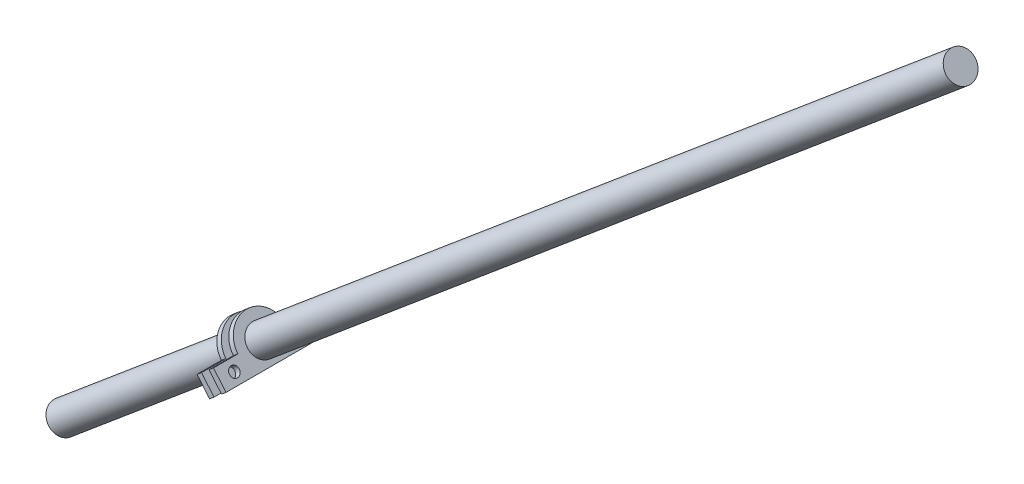
from build123d import *

# Parameters (mm, degrees)
S_P_R1_PROFILE_R            = 7.5
Y_KSEKLIK_EKSTR_ZYON1_START = -125
IZIM8_R                     = 2.5
Y_KSEKLIK_EKSTR_ZYON1_DEPTH = 3
Y_KSEKLIK_EKSTR_ZYON2_START = -133
IZIM8_3_R                   = 2.5
Y_KSEKLIK_EKSTR_ZYON2_DEPTH = 3


with BuildPart() as part:
    # Süpür1: sweep along a path in Çizim1
    with BuildLine(Plane.XY) as s_p_r1_path:
        Line((0, 0), (459.626665871, 385.672565812))
    # Süpür1 profile (on start of the path) → Süpür1 (sweep)
    with BuildSketch(Plane(origin=(0, 0, 0), x_dir=(-0.642787609686541, 0.7660444431189767, 0), z_dir=(0.7660444431189767, 0.642787609686541, 0))):
        Circle(S_P_R1_PROFILE_R)
    sweep(path=s_p_r1_path.line)

    # Çizim8 → Yükseklik-Ekstrüzyon1 (add)
    with BuildSketch(Plane(origin=(0, 0, 0), x_dir=(0, 0, 1), z_dir=(-0.7660444431189768, -0.642787609686541, 0)).offset(Y_KSEKLIK_EKSTR_ZYON1_START)):
        with BuildLine():
            Line((-25, -10), (25, -10))
            Line((25, -10), (25, 0))
            Line((25, 0), (12.5, 0))
            ThreePointArc((12.5, 0), (0, 12.5), (-12.5, 0))
            Line((-12.5, 0), (-25, 0))
            Line((-25, 0), (-25, -10))
        make_face()
        with Locations((17.5, -5)):
            Circle(IZIM8_R, mode=Mode.SUBTRACT)
        with Locations((-17.5, -5)):
            Circle(IZIM8_R, mode=Mode.SUBTRACT)
    extrude(amount=Y_KSEKLIK_EKSTR_ZYON1_DEPTH)

    # Çizim8<3> → Yükseklik-Ekstrüzyon2 (add)
    with BuildSketch(Plane(origin=(0, 0, 0), x_dir=(0, 0, 1), z_dir=(-0.7660444431189768, -0.642787609686541, 0)).offset(Y_KSEKLIK_EKSTR_ZYON2_START)):
        with BuildLine():
            Line((-25, -10), (25, -10))
            Line((25, -10), (25, 0))
            Line((25, 0), (12.5, 0))
            ThreePointArc((12.5, 0), (0, 12.5), (-12.5, 0))
            Line((-12.5, 0), (-25, 0))
            Line((-25, 0), (-25, -10))
        make_face()
        with Locations((17.5, -5)):
            Circle(IZIM8_3_R, mode=Mode.SUBTRACT)
        with Locations((-17.5, -5)):
            Circle(IZIM8_3_R, mode=Mode.SUBTRACT)
    extrude(amount=Y_KSEKLIK_EKSTR_ZYON2_DEPTH)


solid = part.part
